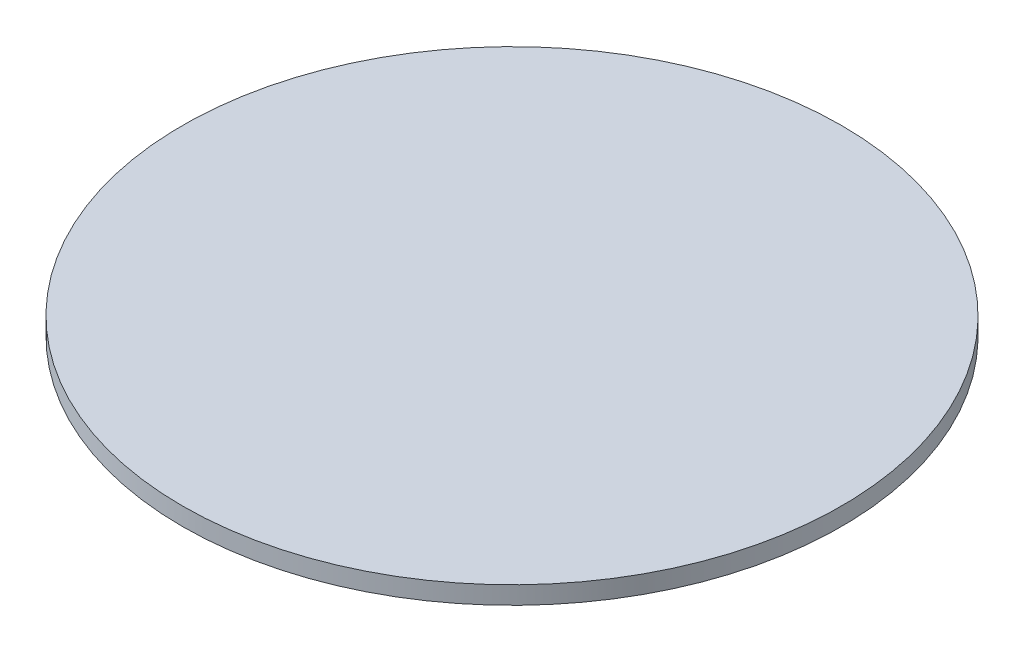
from build123d import *

# Parameters (mm, degrees)
SKETCH_1_R      = 18.5
EXTRUDE_1_DEPTH = 1


with BuildPart() as part:
    # 草图1 → 凸台-拉伸1 (new body)
    with BuildSketch(Plane(origin=(0, 0, 0), x_dir=(1, 0, 0), z_dir=(0, 1, 0))):
        with Locations(Location((0, 0, 0), (0, 0, 270))):
            Circle(SKETCH_1_R)
    extrude(amount=EXTRUDE_1_DEPTH)


solid = part.part
